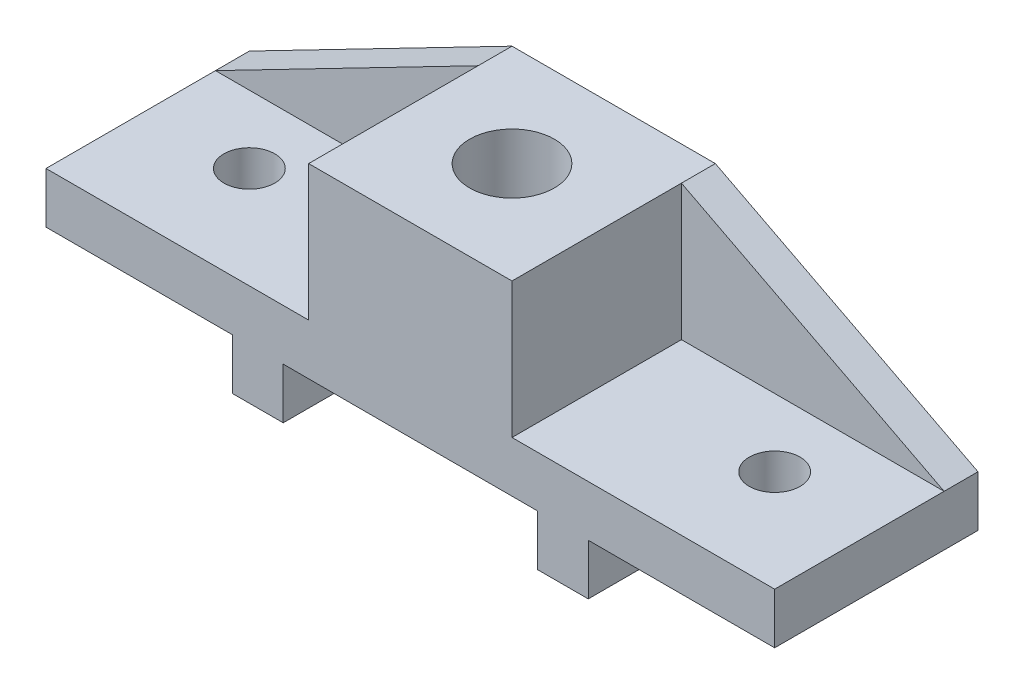
from build123d import *

# Parameters (mm, degrees)
BOSS_EXTRUDE1_DEPTH = 76.2
BOSS_EXTRUDE2_DEPTH = 12.7
SKETCH3_R           = 15.875
CUT_EXTRUDE1_DEPTH  = 298.095864158
SKETCH4_R           = 9.525
CUT_EXTRUDE2_DEPTH  = 288.998927949


with BuildPart() as part:
    # Sketch1 → Boss-Extrude1 (new body)
    with BuildSketch(Plane.XY):
        Polygon((0, 0), (69.85, 0), (69.85, -19.05), (88.9, -19.05), (88.9, 0), (184.15, 0), (184.15, -19.05), (203.2, -19.05), (203.2, 0), (273.05, 0), (273.05, 19.05), (174.625, 19.05), (174.625, 69.85), (98.425, 69.85), (98.425, 19.05), (0, 19.05), align=None)
    extrude(amount=-BOSS_EXTRUDE1_DEPTH)

    # Sketch2 → Boss-Extrude2 (add)
    with BuildSketch(Plane(origin=(0, 0, -76.2), x_dir=(-1, 0, 0), z_dir=(0, 0, -1))):
        Polygon((-98.425, 69.85), (0, 19.05), (-98.425, 19.05), align=None)
        Polygon((-273.05, 19.05), (-174.625, 69.85), (-174.625, 19.05), align=None)
    extrude(amount=-BOSS_EXTRUDE2_DEPTH)

    # Sketch3 → Cut-Extrude1 (cut, through all)
    with BuildSketch(Plane(origin=(0, 69.85, 0), x_dir=(1, 0, 0), z_dir=(0, 1, 0))):
        with Locations(Location((136.525, 38.1, 0), (0, 0, 180))):
            Circle(SKETCH3_R)
    extrude(amount=-CUT_EXTRUDE1_DEPTH, mode=Mode.SUBTRACT)

    # Sketch4 → Cut-Extrude2 (cut, through all)
    with BuildSketch(Plane(origin=(0, 19.05, 0), x_dir=(1, 0, 0), z_dir=(0, 1, 0))):
        with Locations(Location((234.95, 38.1, 0), (0, 0, 270))):
            Circle(SKETCH4_R)
        with Locations(Location((38.1, 38.1, 0), (0, 0, 270))):
            Circle(SKETCH4_R)
    extrude(amount=-CUT_EXTRUDE2_DEPTH, mode=Mode.SUBTRACT)


solid = part.part
